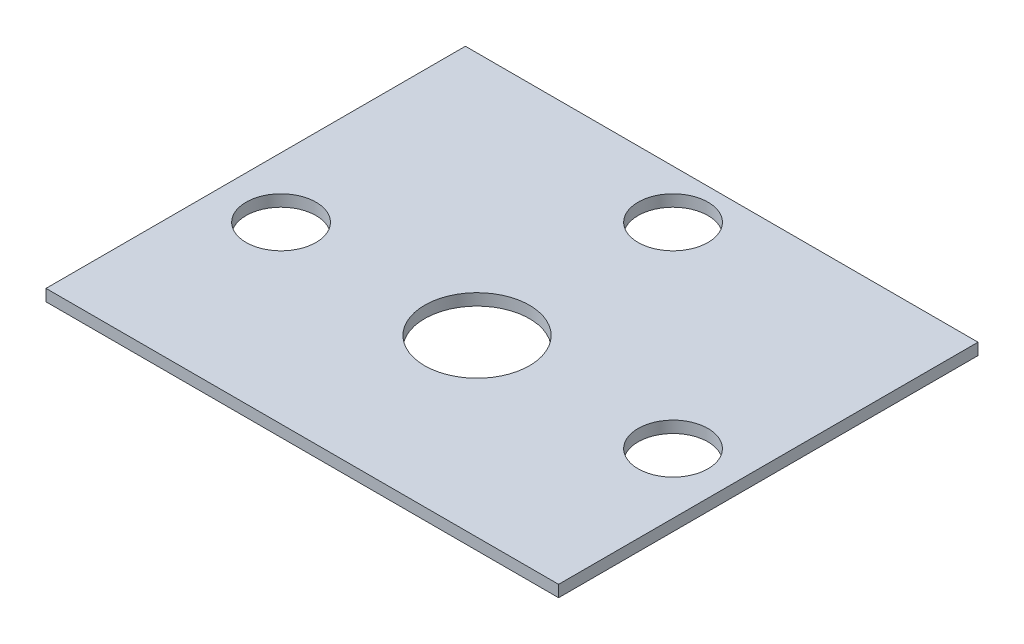
from build123d import *

# Parameters (mm, degrees)
SKETCH1_W           = 139.7
SKETCH1_H           = 114.3
SKETCH1_R           = 9.525
SKETCH1_R_2         = 14.2875
BOSS_EXTRUDE1_DEPTH = 1.5875


with BuildPart() as part:
    # Sketch1 → Boss-Extrude1 (new, symmetric)
    with BuildSketch(Plane(origin=(0, 0, 0), x_dir=(1, 0, 0), z_dir=(0, 1, 0))):
        Rectangle(SKETCH1_W, SKETCH1_H)
        with Locations(Location((0, 43.8912, 0), (0, 0, 270))):
            Circle(SKETCH1_R, mode=Mode.SUBTRACT)
        with Locations(Location((-53.4162, -9.525, 0), (0, 0, 270))):
            Circle(SKETCH1_R, mode=Mode.SUBTRACT)
        with Locations(Location((53.4162, -9.525, 0), (0, 0, 270))):
            Circle(SKETCH1_R, mode=Mode.SUBTRACT)
        with Locations(Location((0, -9.525, 0), (0, 0, 270))):
            Circle(SKETCH1_R_2, mode=Mode.SUBTRACT)
    extrude(amount=BOSS_EXTRUDE1_DEPTH, both=True)


solid = part.part
